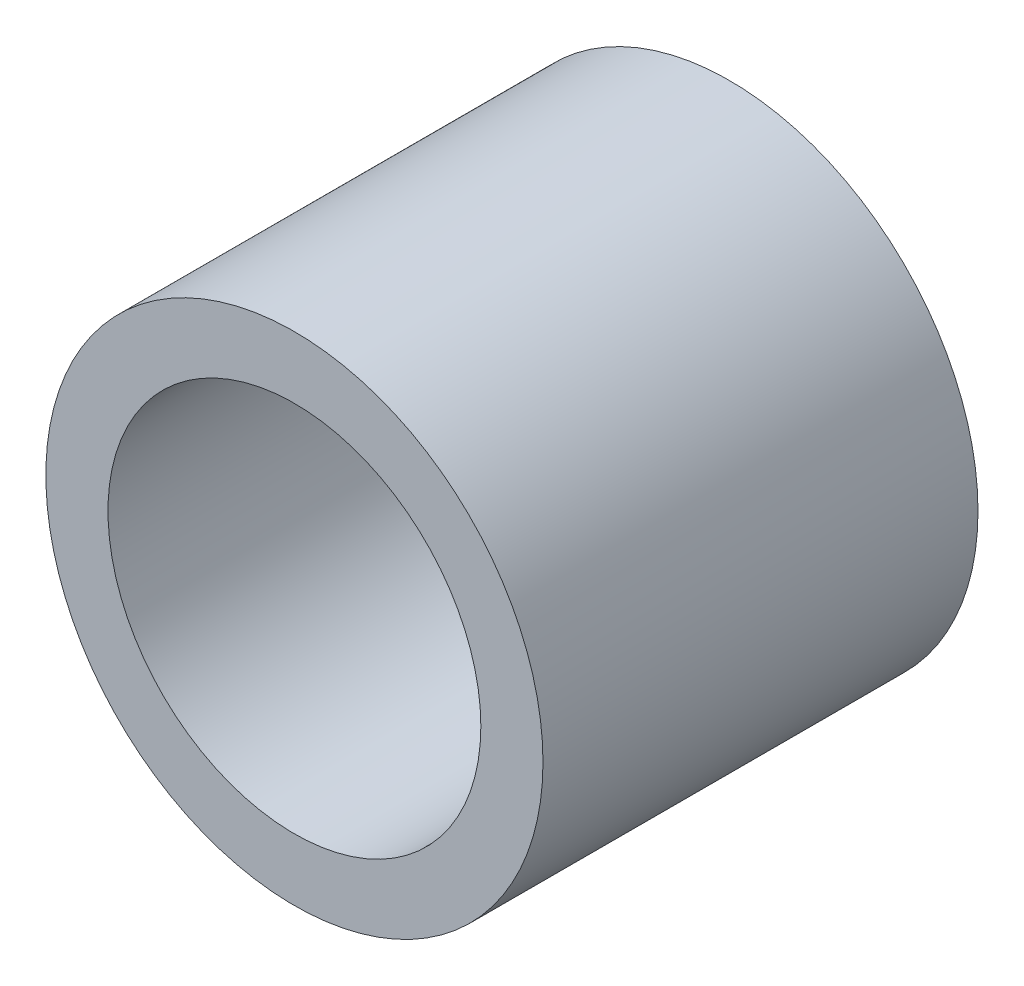
from build123d import *

# Parameters (mm, degrees)
IZIM1_R                     = 40
IZIM1_R_2                   = 30
Y_KSEKLIK_EKSTR_ZYON1_DEPTH = 70


with BuildPart() as part:
    # Çizim1 → Yükseklik-Ekstrüzyon1 (new body)
    with BuildSketch(Plane.XY):
        Circle(IZIM1_R)
        Circle(IZIM1_R_2, mode=Mode.SUBTRACT)
    extrude(amount=Y_KSEKLIK_EKSTR_ZYON1_DEPTH)


solid = part.part
